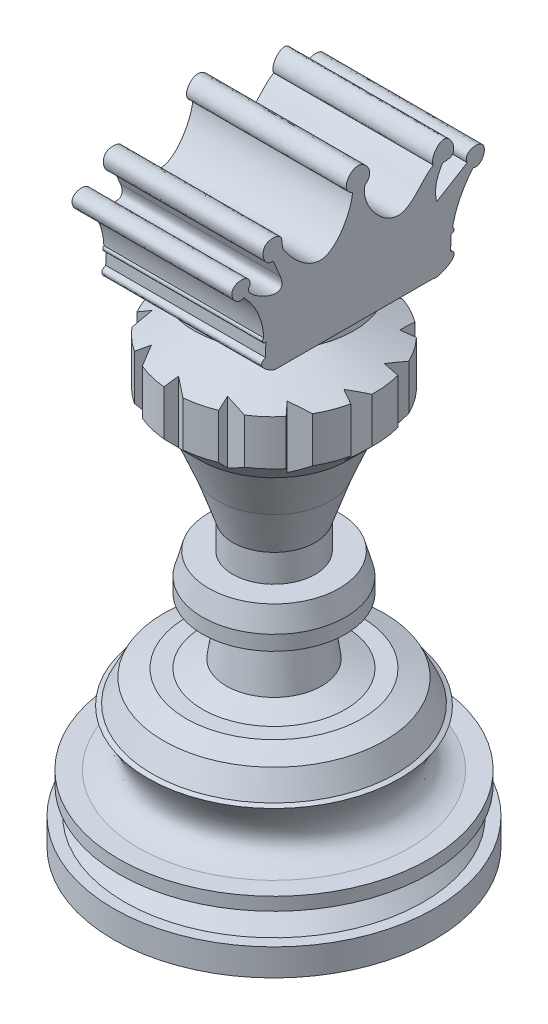
from build123d import *

# Parameters (mm, degrees)
CUT_EXTRUDE2_DEPTH       = 169.926
CIRPATTERN3_COUNT        = 13
BOSS_EXTRUDE1_DEPTH      = 27.94
BOSS_EXTRUDE1_DEPTH_BACK = 27.178
BOSS_EXTRUDE2_DEPTH      = 23.114


with BuildPart() as part:
    # Sketch1 → Revolve6 (revolve)
    with BuildSketch(Plane.XY):
        with BuildLine():
            Line((0, 80.189961357), (0, -88.513071118))
            Line((0, -88.513071118), (55.380691875, -88.513071118))
            Line((55.380691875, -88.513071118), (55.380691875, -79.229602538))
            Line((55.380691875, -79.229602538), (51.5392566, -79.229602538))
            Line((51.5392566, -79.229602538), (46.737462507, -74.427808445))
            Line((46.737462507, -74.427808445), (46.737462507, -69.946133958))
            Line((46.737462507, -69.946133958), (53.459974238, -69.946133958))
            Line((53.459974238, -69.946133958), (53.459974238, -65.464459471))
            Line((53.459974238, -65.464459471), (46.737462507, -65.464459471))
            add(Edge.make_bspline(
                [(46.737462507, -65.464459471), (32.527097047, -62.814977474), (39.108627119, -52.876838259), (43.536266445, -46.257283098)],
                knots=[0, 0, 0, 0, 1, 1, 1, 1], degree=3))
            Line((43.536266445, -46.257283098), (42.066267429, -45.650699391))
            Line((42.066267429, -45.650699391), (38.0942296, -37.783058275))
            Line((38.0942296, -37.783058275), (30.263374956, -35.092027053))
            Line((30.263374956, -35.092027053), (24.663720887, -35.092027053))
            Line((24.663720887, -35.092027053), (16.411034499, -32.256035614))
            Line((16.411034499, -32.256035614), (14.214179509, -17.30502043))
            Line((14.214179509, -17.30502043), (20.763506644, -13.742809212))
            Line((20.763506644, -13.742809212), (24.663724426, -12.645267525))
            Line((24.663724426, -12.645267525), (24.663724426, -7.566666246))
            Line((24.663724426, -7.566666246), (22.53442496, 0))
            Line((22.53442496, 0), (14.214351123, 0))
            Line((14.214351123, 0), (14.214351123, 9.528416987))
            Line((14.214351123, 9.528416987), (19.328671348, 24.411001019))
            Line((19.328671348, 24.411001019), (25.740520878, 39.949520102))
            Line((25.740520878, 39.949520102), (34.786578419, 48.995577643))
            Line((34.786578419, 48.995577643), (34.786578419, 64.582346016))
            Line((34.786578419, 64.582346016), (16.694463337, 72.047917154))
            Line((16.694463337, 72.047917154), (11.734238908, 67.087692725))
            Line((11.734238908, 67.087692725), (5.604005196, 73.217926437))
            Line((5.604005196, 73.217926437), (27.463722614, 79.369365277))
            Line((27.463722614, 79.369365277), (27.217038115, 82.570491931))
            Line((27.217038115, 82.570491931), (5.603830504, 80.189969389))
            ThreePointArc((5.603830504, 80.189969389), (2.801912101, 82.388126628), (0, 80.189961357))
        make_face()
    revolve(axis=Axis((0, 80.189961357, 0), (0, -1, 0)))

    # Sketch8 → Cut-Extrude2 (cut)
    with BuildSketch(Plane(origin=(0, 0, 0), x_dir=(1, 0, 0), z_dir=(0, 1, 0))):
        Polygon((-20.234596357, 36.449786002), (-5.042984201, 30.268174599), (-5.042984201, 42.845718885), align=None)
    cut_extrude2 = extrude(amount=CUT_EXTRUDE2_DEPTH, mode=Mode.SUBTRACT)

    # CirPattern3: Cut-Extrude2 ×13 about axis
    cirpattern3_axis = Axis((0, 64.582346016, 0), (0, 1, 0))
    for i in range(1, CIRPATTERN3_COUNT):
        add(cut_extrude2.rotate(cirpattern3_axis, i * 360 / CIRPATTERN3_COUNT), mode=Mode.SUBTRACT)

    # Sketch9 → Boss-Extrude1 (add, two sides: drawn at the far end of the back side and taken through both)
    with BuildSketch(Plane(origin=(0, 0, 0), x_dir=(0, 0, -1), z_dir=(1, 0, 0)).offset(-BOSS_EXTRUDE1_DEPTH_BACK)):
        with BuildLine():
            add(Edge.make_bspline(
                [(40.719019528, 107.97438063), (35.459127034, 101.80443387), (33.632225228, 93.80079203)],
                knots=[0, 0, 0, 1, 1, 1], degree=2))
            add(Edge.make_bspline(
                [(33.632225228, 93.80079203), (34.983510132, 92.477687925), (33.154463815, 91.969373278)],
                knots=[0, 0, 0, 1, 1, 1], degree=2))
            Line((33.154463815, 91.969373278), (32.993655937, 87.041499092))
            add(Edge.make_bspline(
                [(32.993655937, 87.041499092), (37.389322203, 84.799376517), (28.599816623, 80.723970233), (27.09061417, 81.743863231)],
                knots=[0, 0, 0, 0, 1, 1, 1, 1], degree=3))
            Line((27.09061417, 81.743863231), (-27.530927073, 81.864734281))
            add(Edge.make_bspline(
                [(-27.530927073, 81.864734281), (-29.117066084, 82.160596701), (-34.780082047, 85.529213037), (-30.879272011, 87.096523247)],
                knots=[0, 0, 0, 0, 1, 1, 1, 1], degree=3))
            Line((-30.879272011, 87.096523247), (-30.753709076, 91.658643225))
            add(Edge.make_bspline(
                [(-30.753709076, 91.658643225), (-31.506601645, 91.417501174), (-32.146152133, 92.373599047), (-31.732145953, 93.149934328), (-31.507086687, 93.290961383)],
                knots=[0, 0, 0, 0, 0.709491386, 1, 1, 1, 1], degree=3))
            add(Edge.make_bspline(
                [(-31.507086687, 93.290961383), (-31.925301959, 102.068354213), (-38.346744321, 108.761822858)],
                knots=[0, 0, 0, 1, 1, 1], degree=2))
            add(Edge.make_bspline(
                [(-38.346744321, 108.761822858), (-40.705564252, 107.284082304), (-46.155152804, 114.999808928), (-35.567449827, 115.273569441), (-36.198058925, 111.087172415)],
                knots=[0, 0, 0, 0, 0.453037144, 1, 1, 1, 1], degree=3))
            add(Edge.make_bspline(
                [(-36.198058925, 111.087172415), (-40.413463201, 109.332502632), (-21.803899981, 98.805556198), (-25.746534802, 108.761822858)],
                knots=[0, 0, 0, 0, 1, 1, 1, 1], degree=3))
            Line((-25.746534802, 108.761822858), (-28.286157487, 114.70125085))
            add(Edge.make_bspline(
                [(-28.286157487, 114.70125085), (-31.348061125, 113.977622736), (-33.719060353, 122.257813537), (-24.334542703, 121.414545068), (-25.436391127, 118.45935401), (-24.769756847, 116.45945117)],
                knots=[0, 0, 0, 0, 0.455483331, 0.74806966, 1, 1, 1, 1], degree=3))
            add(Edge.make_bspline(
                [(-24.769756847, 116.45945117), (-22.692205879, 112.773843412), (-9.660088644, 98.689226203), (-0.907148653, 117.303026938), (-0.866381099, 121.484305964)],
                knots=[0, 0, 0, 0, 0.479058101, 1, 1, 1, 1], degree=3))
            add(Edge.make_bspline(
                [(-0.866381099, 121.484305964), (-5.057128369, 123.041470217), (0.409580119, 133.396324545), (7.158535476, 124.005651708), (3.459212532, 121.484305964)],
                knots=[0, 0, 0, 0, 0.493892871, 1, 1, 1, 1], degree=3))
            add(Edge.make_bspline(
                [(3.459212532, 121.484305964), (1.72005108, 115.791937485), (15.325033666, 98.347036047), (23.772002615, 114.040079852), (27.09061417, 115.58035101)],
                knots=[0, 0, 0, 0, 0.599093059, 1, 1, 1, 1], degree=3))
            add(Edge.make_bspline(
                [(27.09061417, 115.58035101), (25.700952757, 117.71170074), (31.260760663, 125.804460978), (35.740537824, 114.936362705), (31.428085393, 114.698710884), (30.282890095, 114.70125085)],
                knots=[0, 0, 0, 0, 0.452982853, 0.806579392, 1, 1, 1, 1], degree=3))
            add(Edge.make_bspline(
                [(30.282890095, 114.70125085), (26.813485295, 109.645481119), (28.168225017, 104.137205939)],
                knots=[0, 0, 0, 1, 1, 1], degree=2))
            Line((28.168225017, 104.137205939), (38.720210838, 110.533242037))
            add(Edge.make_bspline(
                [(38.720210838, 110.533242037), (37.045763397, 114.093593041), (47.579677002, 116.194880933), (43.764183404, 106.795795291), (40.719019528, 107.97438063)],
                knots=[0, 0, 0, 0, 0.508238716, 1, 1, 1, 1], degree=3))
        make_face()
    extrude(amount=BOSS_EXTRUDE1_DEPTH + BOSS_EXTRUDE1_DEPTH_BACK)

    # Sketch9<2> → Boss-Extrude2 (add)
    with BuildSketch(Plane(origin=(0, 0, 0), x_dir=(0, 0, -1), z_dir=(1, 0, 0))):
        with BuildLine():
            add(Edge.make_bspline(
                [(40.719019528, 107.97438063), (35.459127034, 101.80443387), (33.632225228, 93.80079203)],
                knots=[0, 0, 0, 1, 1, 1], degree=2))
            add(Edge.make_bspline(
                [(33.632225228, 93.80079203), (34.983510132, 92.477687925), (33.154463815, 91.969373278)],
                knots=[0, 0, 0, 1, 1, 1], degree=2))
            Line((33.154463815, 91.969373278), (32.993655937, 87.041499092))
            add(Edge.make_bspline(
                [(32.993655937, 87.041499092), (37.389322203, 84.799376517), (28.599816623, 80.723970233), (27.09061417, 81.743863231)],
                knots=[0, 0, 0, 0, 1, 1, 1, 1], degree=3))
            Line((27.09061417, 81.743863231), (-27.530927073, 81.864734281))
            add(Edge.make_bspline(
                [(-27.530927073, 81.864734281), (-29.117066084, 82.160596701), (-34.780082047, 85.529213037), (-30.879272011, 87.096523247)],
                knots=[0, 0, 0, 0, 1, 1, 1, 1], degree=3))
            Line((-30.879272011, 87.096523247), (-30.753709076, 91.658643225))
            add(Edge.make_bspline(
                [(-30.753709076, 91.658643225), (-31.506601645, 91.417501174), (-32.146152133, 92.373599047), (-31.732145953, 93.149934328), (-31.507086687, 93.290961383)],
                knots=[0, 0, 0, 0, 0.709491386, 1, 1, 1, 1], degree=3))
            add(Edge.make_bspline(
                [(-31.507086687, 93.290961383), (-31.925301959, 102.068354213), (-38.346744321, 108.761822858)],
                knots=[0, 0, 0, 1, 1, 1], degree=2))
            add(Edge.make_bspline(
                [(-38.346744321, 108.761822858), (-40.705564252, 107.284082304), (-46.155152804, 114.999808928), (-35.567449827, 115.273569441), (-36.198058925, 111.087172415)],
                knots=[0, 0, 0, 0, 0.453037144, 1, 1, 1, 1], degree=3))
            add(Edge.make_bspline(
                [(-36.198058925, 111.087172415), (-40.413463201, 109.332502632), (-21.803899981, 98.805556198), (-25.746534802, 108.761822858)],
                knots=[0, 0, 0, 0, 1, 1, 1, 1], degree=3))
            Line((-25.746534802, 108.761822858), (-28.286157487, 114.70125085))
            add(Edge.make_bspline(
                [(-28.286157487, 114.70125085), (-31.348061125, 113.977622736), (-33.719060353, 122.257813537), (-24.334542703, 121.414545068), (-25.436391127, 118.45935401), (-24.769756847, 116.45945117)],
                knots=[0, 0, 0, 0, 0.455483331, 0.74806966, 1, 1, 1, 1], degree=3))
            add(Edge.make_bspline(
                [(-24.769756847, 116.45945117), (-22.692205879, 112.773843412), (-9.660088644, 98.689226203), (-0.907148653, 117.303026938), (-0.866381099, 121.484305964)],
                knots=[0, 0, 0, 0, 0.479058101, 1, 1, 1, 1], degree=3))
            add(Edge.make_bspline(
                [(-0.866381099, 121.484305964), (-5.057128369, 123.041470217), (0.409580119, 133.396324545), (7.158535476, 124.005651708), (3.459212532, 121.484305964)],
                knots=[0, 0, 0, 0, 0.493892871, 1, 1, 1, 1], degree=3))
            add(Edge.make_bspline(
                [(3.459212532, 121.484305964), (1.72005108, 115.791937485), (15.325033666, 98.347036047), (23.772002615, 114.040079852), (27.09061417, 115.58035101)],
                knots=[0, 0, 0, 0, 0.599093059, 1, 1, 1, 1], degree=3))
            add(Edge.make_bspline(
                [(27.09061417, 115.58035101), (25.700952757, 117.71170074), (31.260760663, 125.804460978), (35.740537824, 114.936362705), (31.428085393, 114.698710884), (30.282890095, 114.70125085)],
                knots=[0, 0, 0, 0, 0.452982853, 0.806579392, 1, 1, 1, 1], degree=3))
            add(Edge.make_bspline(
                [(30.282890095, 114.70125085), (26.813485295, 109.645481119), (28.168225017, 104.137205939)],
                knots=[0, 0, 0, 1, 1, 1], degree=2))
            Line((28.168225017, 104.137205939), (38.720210838, 110.533242037))
            add(Edge.make_bspline(
                [(38.720210838, 110.533242037), (37.045763397, 114.093593041), (47.579677002, 116.194880933), (43.764183404, 106.795795291), (40.719019528, 107.97438063)],
                knots=[0, 0, 0, 0, 0.508238716, 1, 1, 1, 1], degree=3))
        make_face()
    extrude(amount=BOSS_EXTRUDE2_DEPTH)


solid = part.part
